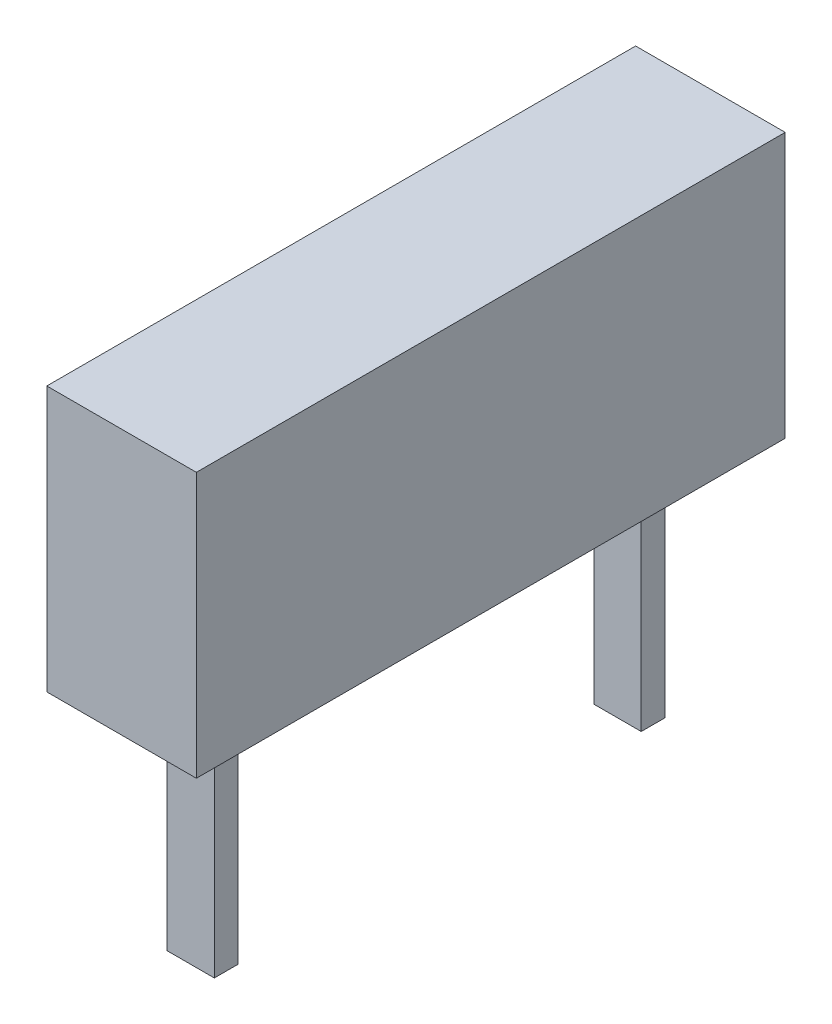
from build123d import *

# Parameters (mm, degrees)
SKETCH_1_W      = 2.54
SKETCH_1_H      = 10
EXTRUDE_1_DEPTH = 4.5
SKETCH_2_W      = 0.8
SKETCH_2_H      = 0.4
EXTRUDE_2_DEPTH = 3.96


with BuildPart() as part:
    # 草图1 → 拉伸1 (new body)
    with BuildSketch(Plane(origin=(0, 0, 0), x_dir=(1, 0, 0), z_dir=(0, 1, 0))):
        Rectangle(SKETCH_1_W, SKETCH_1_H)
    extrude(amount=EXTRUDE_1_DEPTH)

    # 草图2 → 拉伸2 (add)
    with BuildSketch(Plane.XZ):
        with Locations((0, 3.625)):
            Rectangle(SKETCH_2_W, SKETCH_2_H)
        with Locations((0, -3.625)):
            Rectangle(SKETCH_2_W, SKETCH_2_H)
    extrude(amount=EXTRUDE_2_DEPTH)


solid = part.part
